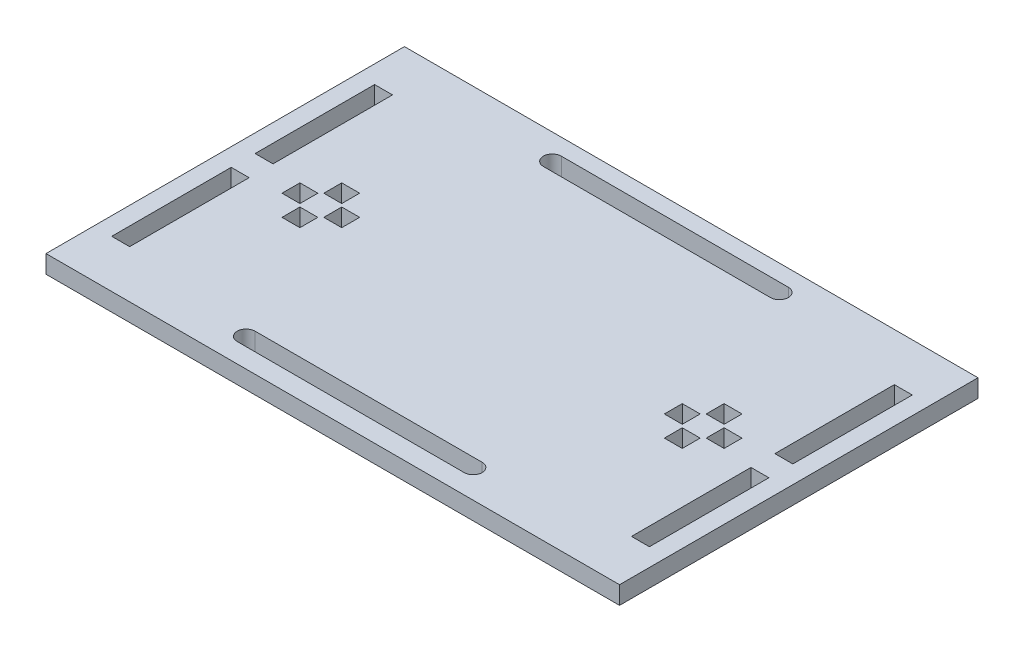
from build123d import *

# Parameters (mm, degrees)
SKETCH_1_W      = 3
SKETCH_1_H      = 20
SKETCH_1_H_2    = 3
EXTRUDE_2_DEPTH = 3


with BuildPart() as part:
    # 草图1 → 凸台-拉伸2 (new body)
    with BuildSketch(Plane(origin=(0, 0, 0), x_dir=(1, 0, 0), z_dir=(0, 1, 0))):
        Polygon((101.75, -0.25), (53.75, -0.25), (5.75, -0.25), (5.75, -60.25), (101.75, -60.25), align=None)
        with BuildLine():
            Line((34.5, -54), (53.75, -54))
            Line((53.75, -54), (72.5, -54))
            ThreePointArc((72.5, -54), (74, -55.5), (72.5, -57))
            Line((72.5, -57), (53.75, -57))
            Line((53.75, -57), (34.5, -57))
            ThreePointArc((34.5, -57), (33, -55.5), (34.5, -54))
        make_face(mode=Mode.SUBTRACT)
        with Locations((10.25, -42.25)):
            Rectangle(SKETCH_1_W, SKETCH_1_H, mode=Mode.SUBTRACT)
        with Locations((18.25, -30.25)):
            Rectangle(SKETCH_1_W, SKETCH_1_H_2, mode=Mode.SUBTRACT)
        with Locations((21.75, -33.75)):
            Rectangle(SKETCH_1_W, SKETCH_1_H_2, mode=Mode.SUBTRACT)
        with Locations((25.25, -30.25)):
            Rectangle(SKETCH_1_W, SKETCH_1_H_2, mode=Mode.SUBTRACT)
        with Locations((97.25, -42.25)):
            Rectangle(SKETCH_1_W, SKETCH_1_H, mode=Mode.SUBTRACT)
        with Locations((85.75, -33.75)):
            Rectangle(SKETCH_1_W, SKETCH_1_H_2, mode=Mode.SUBTRACT)
        with Locations((82.25, -30.25)):
            Rectangle(SKETCH_1_W, SKETCH_1_H_2, mode=Mode.SUBTRACT)
        with Locations((89.25, -30.25)):
            Rectangle(SKETCH_1_W, SKETCH_1_H_2, mode=Mode.SUBTRACT)
        with Locations((21.75, -26.75)):
            Rectangle(SKETCH_1_W, SKETCH_1_H_2, mode=Mode.SUBTRACT)
        with Locations((10.25, -18.25)):
            Rectangle(SKETCH_1_W, SKETCH_1_H, mode=Mode.SUBTRACT)
        with Locations((85.75, -26.75)):
            Rectangle(SKETCH_1_W, SKETCH_1_H_2, mode=Mode.SUBTRACT)
        with Locations((97.25, -18.25)):
            Rectangle(SKETCH_1_W, SKETCH_1_H, mode=Mode.SUBTRACT)
        with BuildLine():
            Line((34.75, -3), (53.75, -3))
            Line((53.75, -3), (72.75, -3))
            ThreePointArc((72.75, -3), (74.25, -4.5), (72.75, -6))
            Line((72.75, -6), (53.75, -6))
            Line((53.75, -6), (34.75, -6))
            ThreePointArc((34.75, -6), (33.25, -4.5), (34.75, -3))
        make_face(mode=Mode.SUBTRACT)
    extrude(amount=EXTRUDE_2_DEPTH)


solid = part.part
